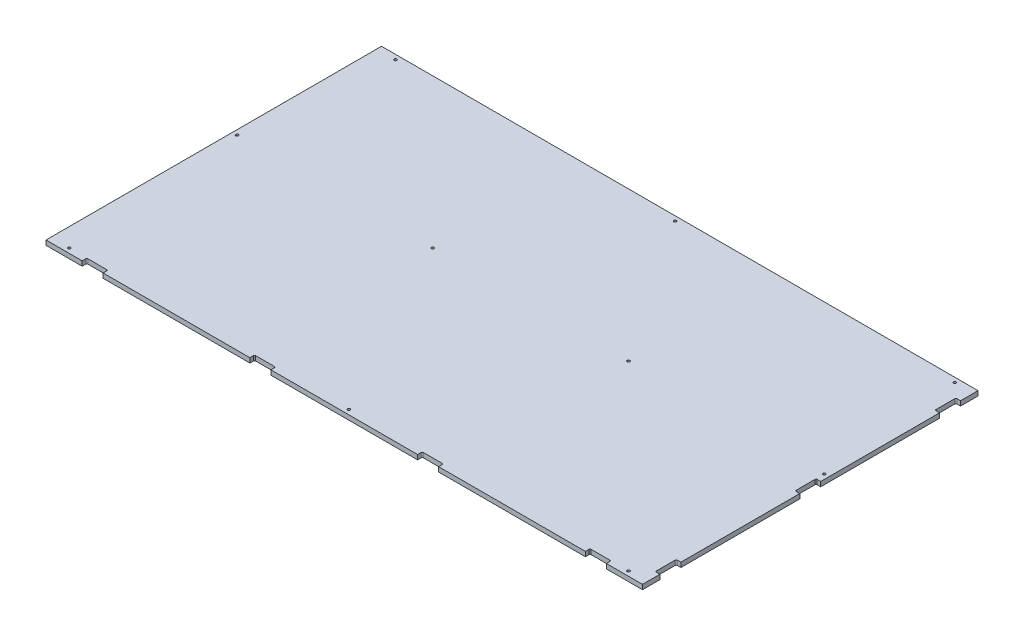
from build123d import *

# Parameters (mm, degrees)
SKETCH1_W                                           = 1625.6
SKETCH1_H                                           = 914.4
BOSS_EXTRUDE1_DEPTH                                 = 12.7
CSK_FOR_1_4_FLAT_HEAD_MACHINE_SCREW_100_D           = 7.14248
CSK_FOR_1_4_FLAT_HEAD_MACHINE_SCREW_100_CSINK_D     = 13.716
CSK_FOR_1_4_FLAT_HEAD_MACHINE_SCREW_100_CSINK_ANGLE = 100
SKETCH5_W                                           = 57.15
SKETCH5_H                                           = 12.7
CUT_EXTRUDE1_DEPTH                                  = 1866.171308486
LPATTERN1_COUNT                                     = 4
LPATTERN1_PITCH                                     = 457.2
SKETCH6_W                                           = 12.7
SKETCH6_H                                           = 57.15
CUT_EXTRUDE2_DEPTH                                  = 1866.171308486
LPATTERN2_COUNT                                     = 3
LPATTERN2_PITCH                                     = 381
FILLET1_R                                           = 3.175


with BuildPart() as part:
    # Sketch1 → Boss-Extrude1 (new body)
    with BuildSketch(Plane(origin=(0, 0, 0), x_dir=(1, 0, 0), z_dir=(0, 1, 0))):
        with Locations((812.8, 457.2)):
            Rectangle(SKETCH1_W, SKETCH1_H)
    extrude(amount=BOSS_EXTRUDE1_DEPTH)

    # CSK for 1/4 Flat Head Machine Screw (100)1 (through all)
    with Locations(Plane(origin=(0, 0, 0), x_dir=(-1, 0, 0), z_dir=(0, -1, 0))):
        with Locations((-50.8, 12.7), (-12.7, 508), (-50.8, 901.7), (-546.1, 508), (-1079.5, 508), (-812.8, 12.7), (-1574.8, 12.7), (-1574.8, 901.7), (-1612.9, 508), (-812.8, 901.7)):
            CounterSinkHole(CSK_FOR_1_4_FLAT_HEAD_MACHINE_SCREW_100_D / 2, CSK_FOR_1_4_FLAT_HEAD_MACHINE_SCREW_100_CSINK_D / 2, counter_sink_angle=CSK_FOR_1_4_FLAT_HEAD_MACHINE_SCREW_100_CSINK_ANGLE)

    # Sketch5 → Cut-Extrude1 (cut, through all)
    with BuildSketch(Plane(origin=(0, 12.7, 0), x_dir=(1, 0, 0), z_dir=(0, 1, 0))):
        with Locations((127, 6.35)):
            Rectangle(SKETCH5_W, SKETCH5_H)
    cut_extrude1 = extrude(amount=-CUT_EXTRUDE1_DEPTH, mode=Mode.SUBTRACT)

    # LPattern1: Cut-Extrude1 ×4
    with Locations(*[(i * LPATTERN1_PITCH, 0, 0) for i in range(1, LPATTERN1_COUNT)]):
        add(cut_extrude1, mode=Mode.SUBTRACT)

    # Sketch6 → Cut-Extrude2 (cut, through all)
    with BuildSketch(Plane(origin=(0, 12.7, 0), x_dir=(1, 0, 0), z_dir=(0, 1, 0))):
        with Locations((1619.25, 76.2)):
            Rectangle(SKETCH6_W, SKETCH6_H)
    cut_extrude2 = extrude(amount=-CUT_EXTRUDE2_DEPTH, mode=Mode.SUBTRACT)

    # LPattern2: Cut-Extrude2 ×3
    with Locations(*[(0, 0, -i * LPATTERN2_PITCH) for i in range(1, LPATTERN2_COUNT)]):
        add(cut_extrude2, mode=Mode.SUBTRACT)

    # Fillet1
    fillet1_edges = [part.edges().sort_by_distance(p)[0] for p in [
        (555.625, 6.35, -12.7),
        (612.775, 6.35, -12.7),
        (1012.825, 6.35, -12.7),
        (1069.975, 6.35, -12.7),
        (1470.025, 6.35, -12.7),
        (1527.175, 6.35, -12.7),
        (1612.9, 6.35, -47.625),
        (1612.9, 6.35, -104.775),
        (1612.9, 6.35, -428.625),
        (1612.9, 6.35, -485.775),
        (1612.9, 6.35, -809.625),
        (1612.9, 6.35, -866.775),
        (98.425, 6.35, -12.7),
        (155.575, 6.35, -12.7),
    ]]
    fillet(fillet1_edges, radius=FILLET1_R)


solid = part.part
